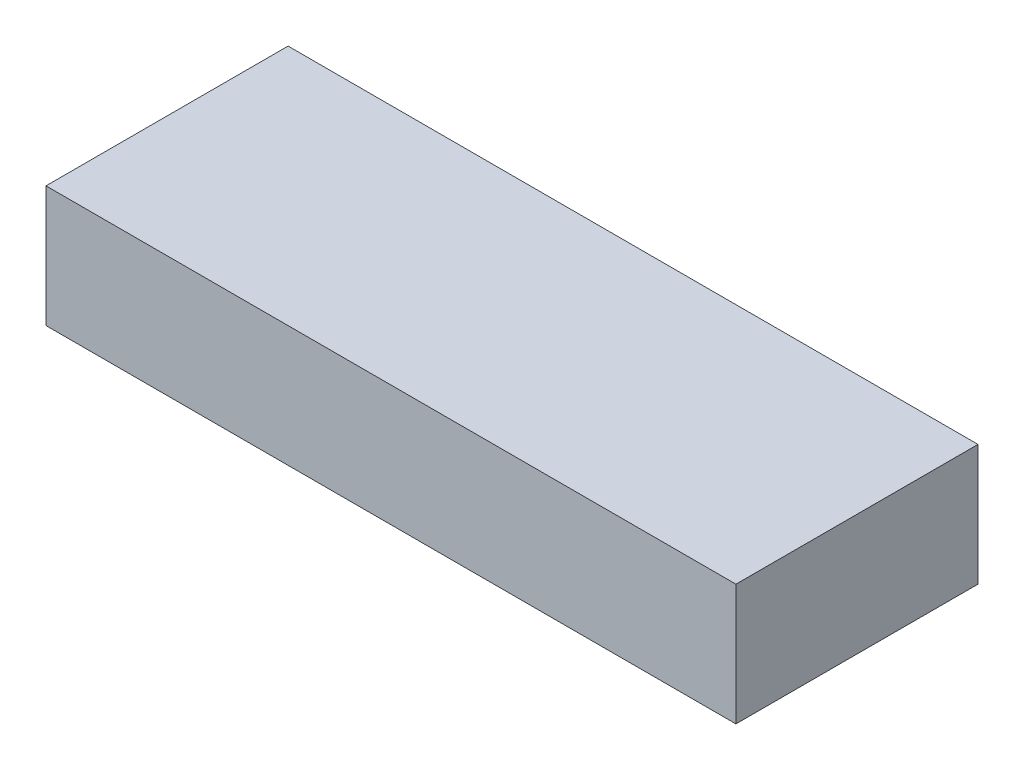
from build123d import *

# Parameters (mm, degrees)
SKETCH1_W           = 57
SKETCH1_H           = 20
BOSS_EXTRUDE1_DEPTH = 10


with BuildPart() as part:
    # Sketch1 → Boss-Extrude1 (new body)
    with BuildSketch(Plane(origin=(0, 0, 0), x_dir=(1, 0, 0), z_dir=(0, 1, 0))):
        with Locations((28.5, 10)):
            Rectangle(SKETCH1_W, SKETCH1_H)
    extrude(amount=-BOSS_EXTRUDE1_DEPTH)


solid = part.part
